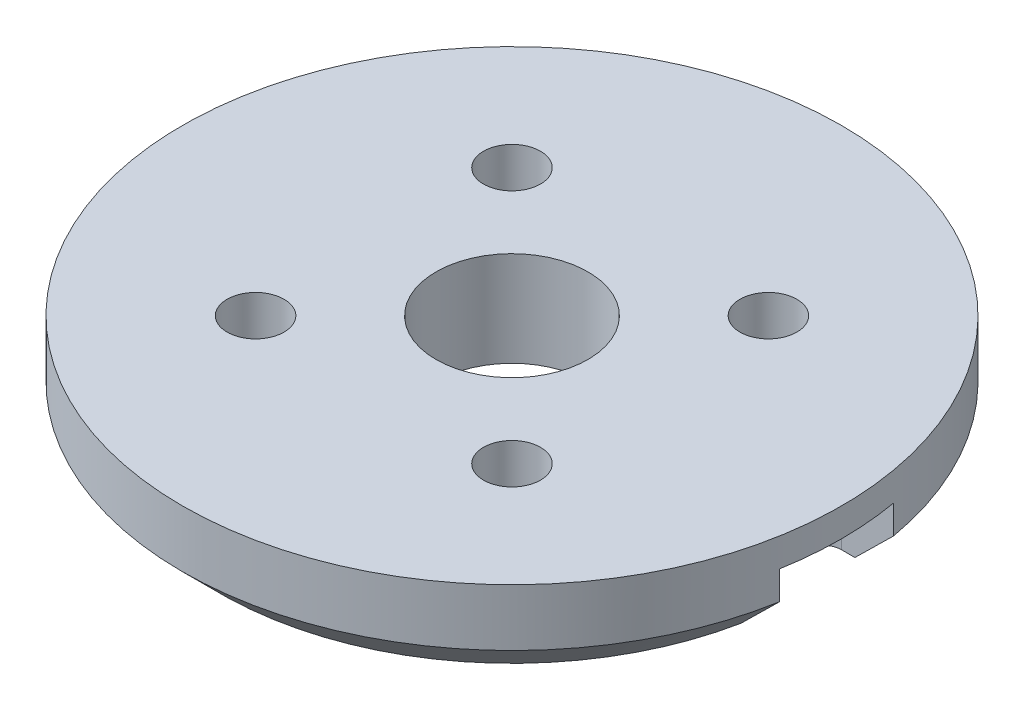
from build123d import *

# Parameters (mm, degrees)
SKETCH_1_R          = 17.35
EXTRUDE_1_DEPTH     = 5
CHAMFER_1_SIZE      = 2
SKETCH_2_R          = 4
CUT_EXTRUDE_1_DEPTH = 5
SKETCH_3_R          = 1.5
CUT_EXTRUDE_2_DEPTH = 5
CUT_EXTRUDE_3_DEPTH = 3.5


with BuildPart() as part:
    # 草图1 → 凸台-拉伸1 (new body)
    with BuildSketch(Plane(origin=(0, 0, 0), x_dir=(1, 0, 0), z_dir=(0, 1, 0))):
        with Locations(Location((0, 0, 0), (0, 0, 270))):
            Circle(SKETCH_1_R)
    extrude(amount=EXTRUDE_1_DEPTH)

    # 倒角1
    chamfer_1_edges = [part.edges().sort_by_distance(p)[0] for p in [
        (0, 0, -17.35),
    ]]
    chamfer(chamfer_1_edges, length=CHAMFER_1_SIZE)

    # 草图2 → 切除-拉伸1 (cut)
    with BuildSketch(Plane(origin=(0, 5, 0), x_dir=(1, 0, 0), z_dir=(0, 1, 0))):
        with Locations(Location((0, 0, 0), (0, 0, 270))):
            Circle(SKETCH_2_R)
    extrude(amount=-CUT_EXTRUDE_1_DEPTH, mode=Mode.SUBTRACT)

    # 草图3 → 切除-拉伸2 (cut)
    with BuildSketch(Plane.XZ):
        with Locations(Location((-6.75, 6.75, 0), (0, 0, 270))):
            Circle(SKETCH_3_R)
        with Locations(Location((6.75, 6.75, 0), (0, 0, 270))):
            Circle(SKETCH_3_R)
        with Locations(Location((6.75, -6.75, 0), (0, 0, 270))):
            Circle(SKETCH_3_R)
        with Locations(Location((-6.75, -6.75, 0), (0, 0, 270))):
            Circle(SKETCH_3_R)
    extrude(amount=-CUT_EXTRUDE_2_DEPTH, mode=Mode.SUBTRACT)

    # 草图4 → 切除-拉伸3 (cut)
    with BuildSketch(Plane.XZ):
        with BuildLine():
            Line((14.35, 3), (21.35, 3))
            Line((21.35, 3), (21.35, -3))
            Line((21.35, -3), (14.35, -3))
            ThreePointArc((14.35, -3), (13.642893219, -2.707106781), (13.35, -2))
            Line((13.35, -2), (13.35, 2))
            ThreePointArc((13.35, 2), (13.642893219, 2.707106781), (14.35, 3))
        make_face()
    extrude(amount=-CUT_EXTRUDE_3_DEPTH, mode=Mode.SUBTRACT)


solid = part.part
